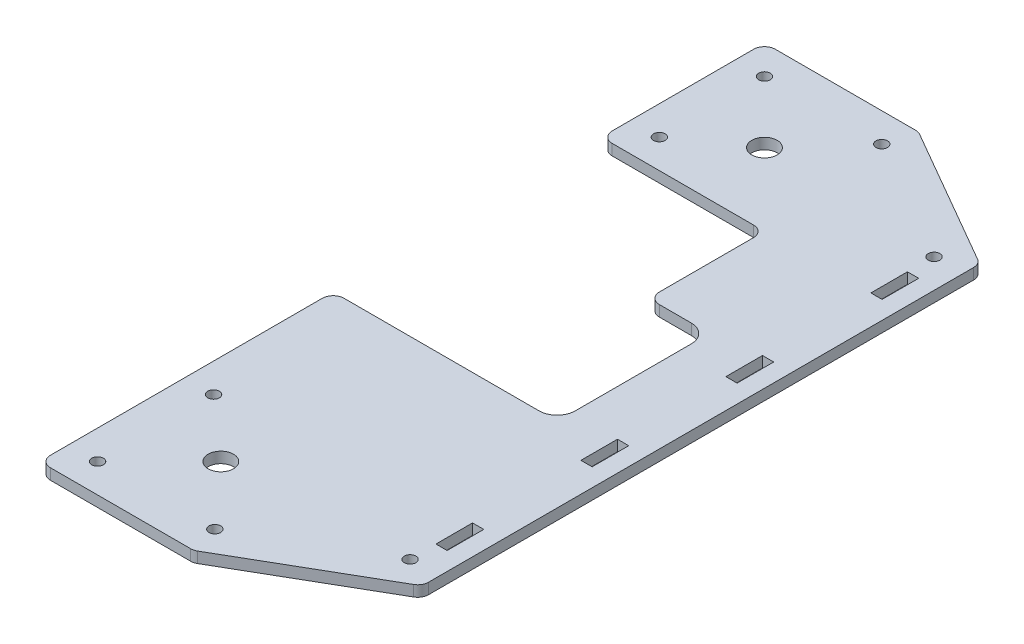
from build123d import *

# Parameters (mm, degrees)
BOSS_EXTRUDE1_DEPTH = 3
CUT_EXTRUDE1_REACH  = 162.106
SKETCH2_W           = 45
SKETCH2_H           = 74
FILLET2_R           = 3
SKETCH3_W           = 3.1
SKETCH3_H           = 10.1
CUT_EXTRUDE2_DEPTH  = 161.106214745
CUT_EXTRUDE3_REACH  = 162.106
SKETCH4_R           = 1.6
SKETCH5_R           = 3.5
CUT_EXTRUDE4_DEPTH  = 161.106214745


with BuildPart() as part:
    # Sketch1 → Boss-Extrude1 (new body)
    with BuildSketch(Plane(origin=(0, 0, 0), x_dir=(1, 0, 0), z_dir=(0, 1, 0))):
        Polygon((42.5, 100), (85, 100), (125, 76.905989232), (125, -76.905989232), (85, -100), (42.5, -100), align=None)
        with BuildLine():
            Line((99.3, 23), (67.3, 23))
            ThreePointArc((67.3, 23), (63.764466094, 21.535533906), (62.3, 18))
            Line((62.3, 18), (62.3, -14))
            ThreePointArc((62.3, -14), (63.764466094, -17.535533906), (67.3, -19))
            Line((67.3, -19), (99.3, -19))
            ThreePointArc((99.3, -19), (102.835533906, -17.535533906), (104.3, -14))
            Line((104.3, -14), (104.3, 18))
            ThreePointArc((104.3, 18), (102.835533906, 21.535533906), (99.3, 23))
        make_face(mode=Mode.SUBTRACT)
    extrude(amount=BOSS_EXTRUDE1_DEPTH)

    # Sketch2 → Cut-Extrude1 (cut, up to next)
    with BuildSketch(Plane(origin=(0, 3, 0), x_dir=(1, 0, 0), z_dir=(0, 1, 0)), mode=Mode.PRIVATE) as cut_extrude1_sk1:
        with Locations((65, 18)):
            Rectangle(SKETCH2_W, SKETCH2_H)
    cut_extrude1_tool1 = extrude(cut_extrude1_sk1.sketch, amount=-CUT_EXTRUDE1_REACH, mode=Mode.PRIVATE) & part.part
    add(cut_extrude1_tool1.solids().sort_by_distance((65, 3, -18))[0], mode=Mode.SUBTRACT)

    # Fillet2
    fillet2_edges = [part.edges().sort_by_distance(p)[0] for p in [
        (125, 1.5, -76.905989232),
        (125, 1.5, 76.905989232),
        (85, 1.5, 100),
        (42.5, 1.5, 100),
        (42.5, 1.5, -100),
        (85, 1.5, -100),
        (42.5, 1.5, 19),
        (42.5, 1.5, -55),
        (87.5, 1.5, -23),
        (87.5, 1.5, -55),
    ]]
    fillet(fillet2_edges, radius=FILLET2_R)

    # Sketch3 → Cut-Extrude2 (cut, through all)
    with BuildSketch(Plane(origin=(0, 3, 0), x_dir=(1, 0, 0), z_dir=(0, 1, 0))):
        with Locations((118.45, 20)):
            Rectangle(SKETCH3_W, SKETCH3_H)
        with Locations((118.45, -20)):
            Rectangle(SKETCH3_W, SKETCH3_H)
        with Locations((118.45, 60)):
            Rectangle(SKETCH3_W, SKETCH3_H)
        with Locations((118.45, -60)):
            Rectangle(SKETCH3_W, SKETCH3_H)
    extrude(amount=-CUT_EXTRUDE2_DEPTH, mode=Mode.SUBTRACT)

    # Sketch4 → Cut-Extrude3 (cut, up to next)
    with BuildSketch(Plane(origin=(0, 3, 0), x_dir=(1, 0, 0), z_dir=(0, 1, 0)), mode=Mode.PRIVATE) as cut_extrude3_sk1:
        with Locations(Location((50.5, 92, 0), (0, 0, 270))):
            Circle(SKETCH4_R)
    cut_extrude3_tool1 = extrude(cut_extrude3_sk1.sketch, amount=-CUT_EXTRUDE3_REACH, mode=Mode.PRIVATE) & part.part
    # Sketch4 → Cut-Extrude3 (cut, up to next)
    with BuildSketch(Plane(origin=(0, 3, 0), x_dir=(1, 0, 0), z_dir=(0, 1, 0)), mode=Mode.PRIVATE) as cut_extrude3_sk2:
        with Locations(Location((50.5, 63, 0), (0, 0, 270))):
            Circle(SKETCH4_R)
    cut_extrude3_tool2 = extrude(cut_extrude3_sk2.sketch, amount=-CUT_EXTRUDE3_REACH, mode=Mode.PRIVATE) & part.part
    # Sketch4 → Cut-Extrude3 (cut, up to next)
    with BuildSketch(Plane(origin=(0, 3, 0), x_dir=(1, 0, 0), z_dir=(0, 1, 0)), mode=Mode.PRIVATE) as cut_extrude3_sk3:
        with Locations(Location((50.5, -60, 0), (0, 0, 270))):
            Circle(SKETCH4_R)
    cut_extrude3_tool3 = extrude(cut_extrude3_sk3.sketch, amount=-CUT_EXTRUDE3_REACH, mode=Mode.PRIVATE) & part.part
    # Sketch4 → Cut-Extrude3 (cut, up to next)
    with BuildSketch(Plane(origin=(0, 3, 0), x_dir=(1, 0, 0), z_dir=(0, 1, 0)), mode=Mode.PRIVATE) as cut_extrude3_sk4:
        with Locations(Location((50.5, -92, 0), (0, 0, 270))):
            Circle(SKETCH4_R)
    cut_extrude3_tool4 = extrude(cut_extrude3_sk4.sketch, amount=-CUT_EXTRUDE3_REACH, mode=Mode.PRIVATE) & part.part
    # Sketch4 → Cut-Extrude3 (cut, up to next)
    with BuildSketch(Plane(origin=(0, 3, 0), x_dir=(1, 0, 0), z_dir=(0, 1, 0)), mode=Mode.PRIVATE) as cut_extrude3_sk5:
        with Locations(Location((117, 72.287187079, 0), (0, 0, 270))):
            Circle(SKETCH4_R)
    cut_extrude3_tool5 = extrude(cut_extrude3_sk5.sketch, amount=-CUT_EXTRUDE3_REACH, mode=Mode.PRIVATE) & part.part
    # Sketch4 → Cut-Extrude3 (cut, up to next)
    with BuildSketch(Plane(origin=(0, 3, 0), x_dir=(1, 0, 0), z_dir=(0, 1, 0)), mode=Mode.PRIVATE) as cut_extrude3_sk6:
        with Locations(Location((117, -72.287187079, 0), (0, 0, 270))):
            Circle(SKETCH4_R)
    cut_extrude3_tool6 = extrude(cut_extrude3_sk6.sketch, amount=-CUT_EXTRUDE3_REACH, mode=Mode.PRIVATE) & part.part
    # Sketch4 → Cut-Extrude3 (cut, up to next)
    with BuildSketch(Plane(origin=(0, 3, 0), x_dir=(1, 0, 0), z_dir=(0, 1, 0)), mode=Mode.PRIVATE) as cut_extrude3_sk7:
        with Locations(Location((82.856406461, 92, 0), (0, 0, 270))):
            Circle(SKETCH4_R)
    cut_extrude3_tool7 = extrude(cut_extrude3_sk7.sketch, amount=-CUT_EXTRUDE3_REACH, mode=Mode.PRIVATE) & part.part
    # Sketch4 → Cut-Extrude3 (cut, up to next)
    with BuildSketch(Plane(origin=(0, 3, 0), x_dir=(1, 0, 0), z_dir=(0, 1, 0)), mode=Mode.PRIVATE) as cut_extrude3_sk8:
        with Locations(Location((82.856406461, -92, 0), (0, 0, 270))):
            Circle(SKETCH4_R)
    cut_extrude3_tool8 = extrude(cut_extrude3_sk8.sketch, amount=-CUT_EXTRUDE3_REACH, mode=Mode.PRIVATE) & part.part
    add(cut_extrude3_tool1.solids().sort_by_distance((50.5, 3, -92))[0], mode=Mode.SUBTRACT)
    add(cut_extrude3_tool2.solids().sort_by_distance((50.5, 3, -63))[0], mode=Mode.SUBTRACT)
    add(cut_extrude3_tool3.solids().sort_by_distance((50.5, 3, 60))[0], mode=Mode.SUBTRACT)
    add(cut_extrude3_tool4.solids().sort_by_distance((50.5, 3, 92))[0], mode=Mode.SUBTRACT)
    add(cut_extrude3_tool5.solids().sort_by_distance((117, 3, -72.287187))[0], mode=Mode.SUBTRACT)
    add(cut_extrude3_tool6.solids().sort_by_distance((117, 3, 72.287187))[0], mode=Mode.SUBTRACT)
    add(cut_extrude3_tool7.solids().sort_by_distance((82.856406, 3, -92))[0], mode=Mode.SUBTRACT)
    add(cut_extrude3_tool8.solids().sort_by_distance((82.856406, 3, 92))[0], mode=Mode.SUBTRACT)

    # Sketch5 → Cut-Extrude4 (cut, through all)
    with BuildSketch(Plane(origin=(0, 3, 0), x_dir=(1, 0, 0), z_dir=(0, 1, 0))):
        with Locations(Location((67.5, 75, 0), (0, 0, 270))):
            Circle(SKETCH5_R)
        with Locations(Location((67.5, -75, 0), (0, 0, 90))):
            Circle(SKETCH5_R)
    extrude(amount=-CUT_EXTRUDE4_DEPTH, mode=Mode.SUBTRACT)


solid = part.part
